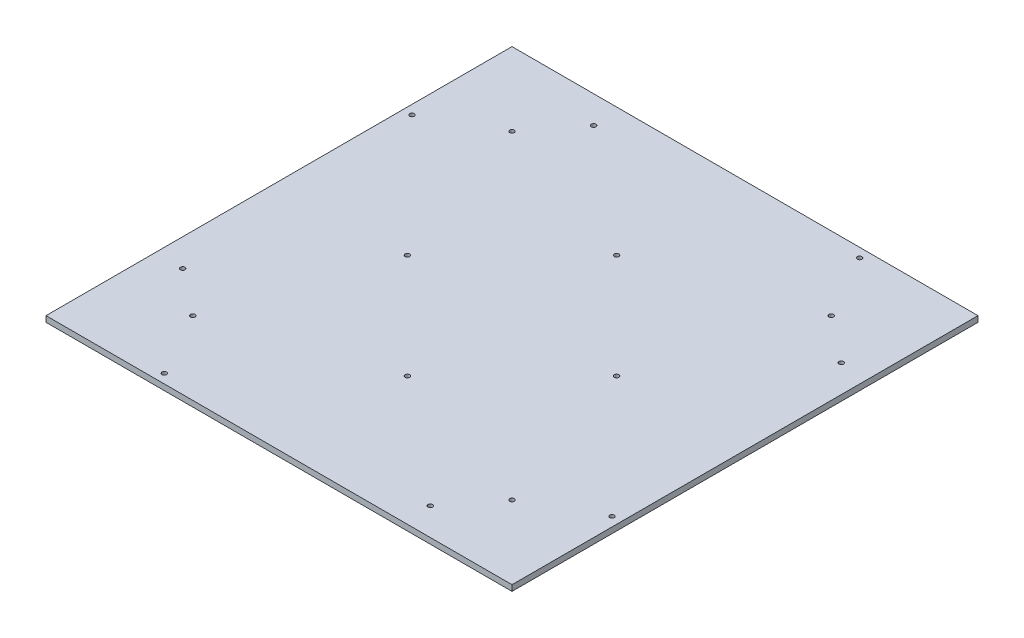
from build123d import *

# Parameters (mm, degrees)
SKETCH1_W             = 254
SKETCH1_H             = 254
BOSS_EXTRUDE1_DEPTH   = 1.5875
M3X0_5_TAPPED_HOLE1_D = 2.5
M3X0_5_TAPPED_HOLE3_D = 2.5


with BuildPart() as part:
    # Sketch1 → Boss-Extrude1 (new, symmetric)
    with BuildSketch(Plane(origin=(0, 0, 0), x_dir=(1, 0, 0), z_dir=(0, 1, 0))):
        Rectangle(SKETCH1_W, SKETCH1_H)
    extrude(amount=BOSS_EXTRUDE1_DEPTH, both=True)

    # M3x0.5 Tapped Hole1 (through all)
    with Locations(Plane(origin=(0, 1.5875, 0), x_dir=(1, 0, 0), z_dir=(0, 1, 0))):
        with Locations((112, 67.5), (67.5, 122), (-67.5, 112), (-122, 67.5), (-112, -67.5), (-67.5, -122), (67.5, -112), (122, -67.5)):
            Hole(M3X0_5_TAPPED_HOLE1_D / 2)

    # M3x0.5 Tapped Hole3 (through all)
    with Locations(Plane(origin=(0, 1.5875, 0), x_dir=(1, 0, 0), z_dir=(0, 1, 0))):
        with Locations((0, 57), (-57, 0), (0, -57), (57, 0), (87, 87), (-87, 87), (-87, -87), (87, -87)):
            Hole(M3X0_5_TAPPED_HOLE3_D / 2)


solid = part.part
